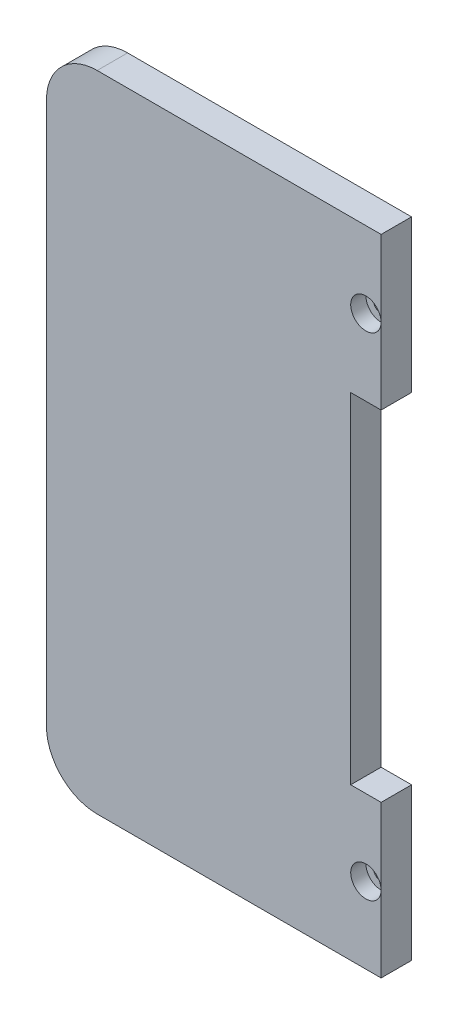
from build123d import *

# Parameters (mm, degrees)
ESQUISSE1_W             = 66
ESQUISSE1_H             = 127
BOSS_EXTRU_1_DEPTH      = 6
CONG_1_R                = 10
ESQUISSE2_R             = 1.5
ESQUISSE2_W             = 6
ESQUISSE2_H             = 67
ENL_V_MAT_EXTRU_1_DEPTH = 72.81399585
ESQUISSE5_R             = 2.995
ENL_V_MAT_EXTRU_4_DEPTH = 3


with BuildPart() as part:
    # Esquisse1 → Boss.-Extru.1 (new body)
    with BuildSketch(Plane.XY):
        Rectangle(ESQUISSE1_W, ESQUISSE1_H)
    extrude(amount=BOSS_EXTRU_1_DEPTH)

    # Congé1
    cong_1_edges = [part.edges().sort_by_distance(p)[0] for p in [
        (-33, -63.5, 3),
        (-33, 63.5, 3),
    ]]
    fillet(cong_1_edges, radius=CONG_1_R)

    # Esquisse2 → Enlèv. mat.-Extru.1 (cut, through all)
    with BuildSketch(Plane(origin=(0, 0, 0), x_dir=(-1, 0, 0), z_dir=(0, 0, -1))):
        with Locations((-30, -48.5)):
            Circle(ESQUISSE2_R)
        with Locations(Location((-30, 48.5, 0), (0, 0, 180))):
            Circle(ESQUISSE2_R)
        with Locations((-30, 0)):
            Rectangle(ESQUISSE2_W, ESQUISSE2_H)
    extrude(amount=-ENL_V_MAT_EXTRU_1_DEPTH, mode=Mode.SUBTRACT)

    # Esquisse5 → Enlèv. mat.-Extru.4 (cut)
    with BuildSketch(Plane.XY.offset(6)):
        with Locations((30, 48.5)):
            Circle(ESQUISSE5_R)
        with Locations((30, -48.5)):
            Circle(ESQUISSE5_R)
    extrude(amount=-ENL_V_MAT_EXTRU_4_DEPTH, mode=Mode.SUBTRACT)


solid = part.part
